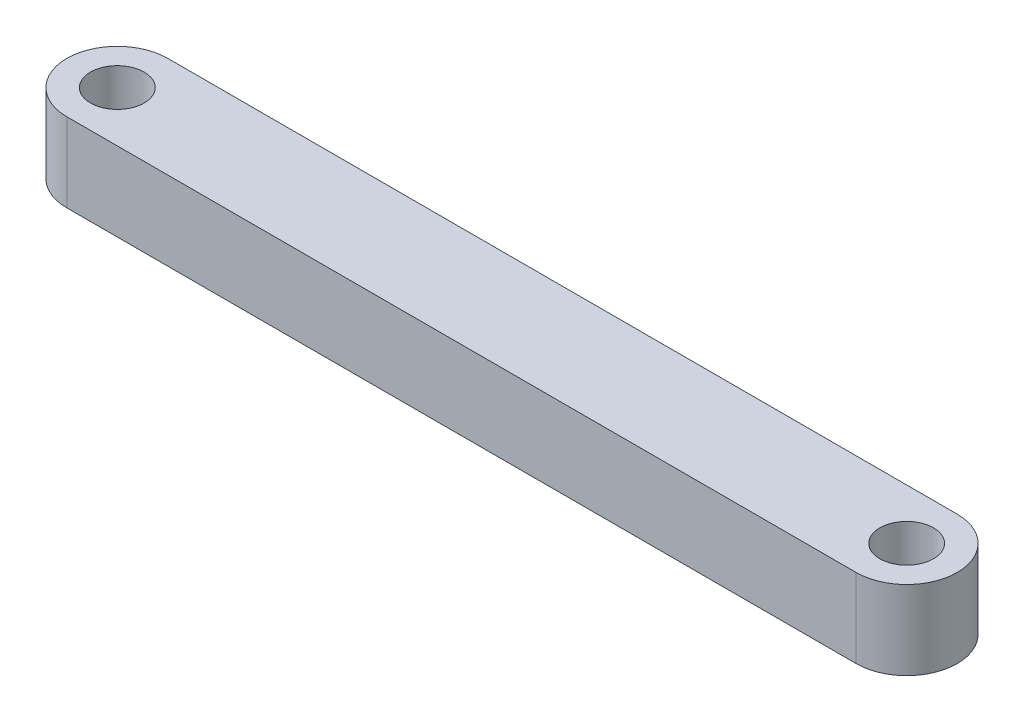
from build123d import *

# Parameters (mm, degrees)
SKETCH1_R           = 2.159
BOSS_EXTRUDE1_DEPTH = 6.35


with BuildPart() as part:
    # Sketch1 → Boss-Extrude1 (new body)
    with BuildSketch(Plane(origin=(0, 0, 0), x_dir=(1, 0, 0), z_dir=(0, 1, 0))):
        with BuildLine():
            Line((0, 4.064), (63.5, 4.064))
            ThreePointArc((63.5, 4.064), (67.564, 0), (63.5, -4.064))
            Line((63.5, -4.064), (0, -4.064))
            ThreePointArc((0, -4.064), (-4.064, 0), (0, 4.064))
        make_face()
        with Locations(Location((0, 0, 0), (0, 0, 270))):
            Circle(SKETCH1_R, mode=Mode.SUBTRACT)
        with Locations(Location((63.5, 0, 0), (0, 0, 90))):
            Circle(SKETCH1_R, mode=Mode.SUBTRACT)
    extrude(amount=BOSS_EXTRUDE1_DEPTH)


solid = part.part
